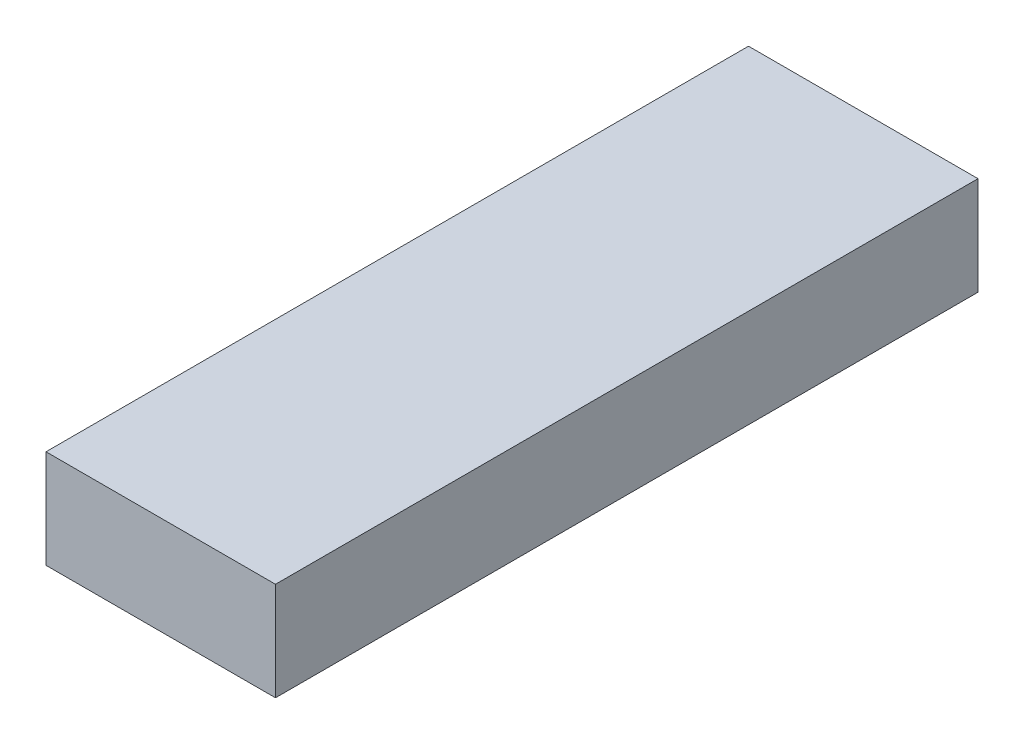
from build123d import *

# Parameters (mm, degrees)
ESBO_O1_W                = 98
ESBO_O1_H                = 300
RESSALTO_EXTRUS_O1_DEPTH = 42


with BuildPart() as part:
    # Esboço1 → Ressalto-extrusão1 (new body)
    with BuildSketch(Plane(origin=(0, 0, 0), x_dir=(1, 0, 0), z_dir=(0, 1, 0))):
        Rectangle(ESBO_O1_W, ESBO_O1_H)
    extrude(amount=RESSALTO_EXTRUS_O1_DEPTH)


solid = part.part
